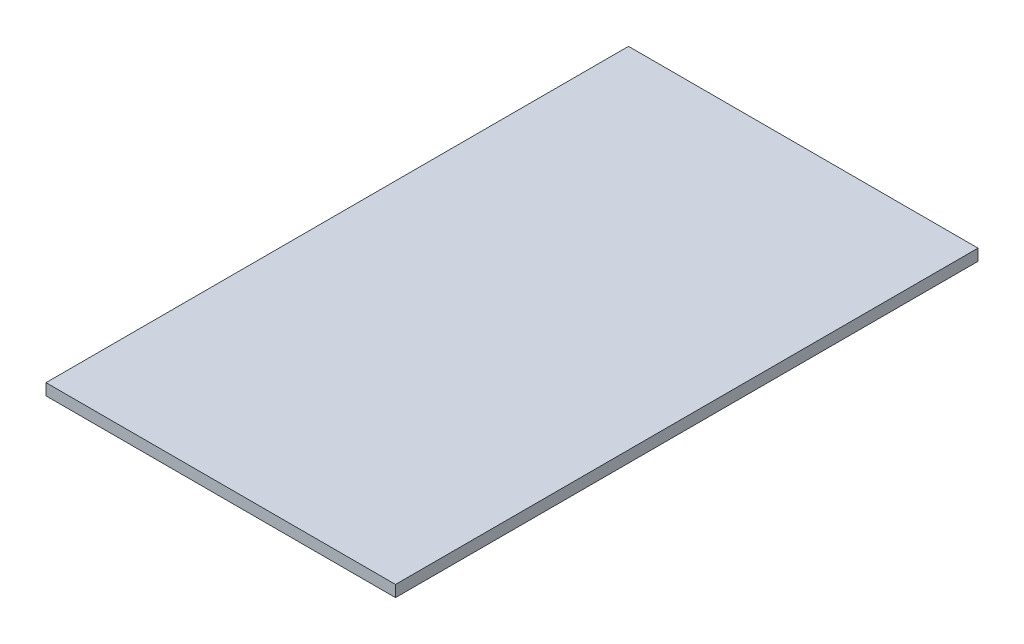
from build123d import *

# Parameters (mm, degrees)
SKETCH1_W           = 30.48
SKETCH1_H           = 50.8
BOSS_EXTRUDE1_DEPTH = 1


with BuildPart() as part:
    # Sketch1 → Boss-Extrude1 (new body)
    with BuildSketch(Plane(origin=(0, 0, 0), x_dir=(1, 0, 0), z_dir=(0, 1, 0))):
        Rectangle(SKETCH1_W, SKETCH1_H)
    extrude(amount=BOSS_EXTRUDE1_DEPTH)


solid = part.part
